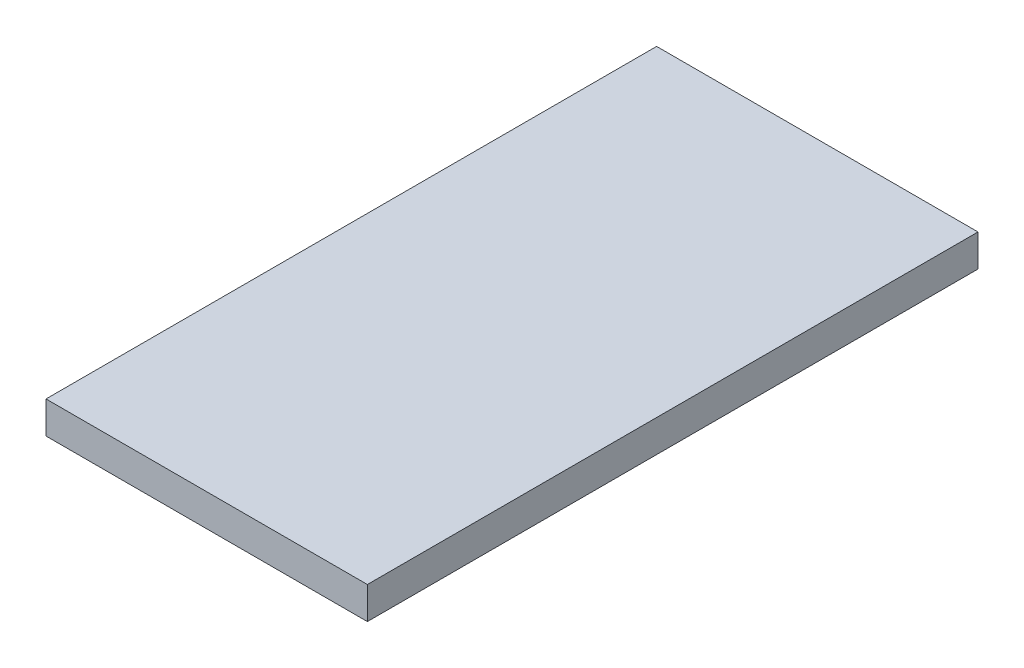
from build123d import *

# Parameters (mm, degrees)
SKETCH1_W           = 50.8
SKETCH1_H           = 96.52
BOSS_EXTRUDE1_DEPTH = 5.08


with BuildPart() as part:
    # Sketch1 → Boss-Extrude1 (new body)
    with BuildSketch(Plane(origin=(0, 0, 0), x_dir=(1, 0, 0), z_dir=(0, 1, 0))):
        with Locations((25.4, 48.26)):
            Rectangle(SKETCH1_W, SKETCH1_H)
    extrude(amount=BOSS_EXTRUDE1_DEPTH)


solid = part.part
